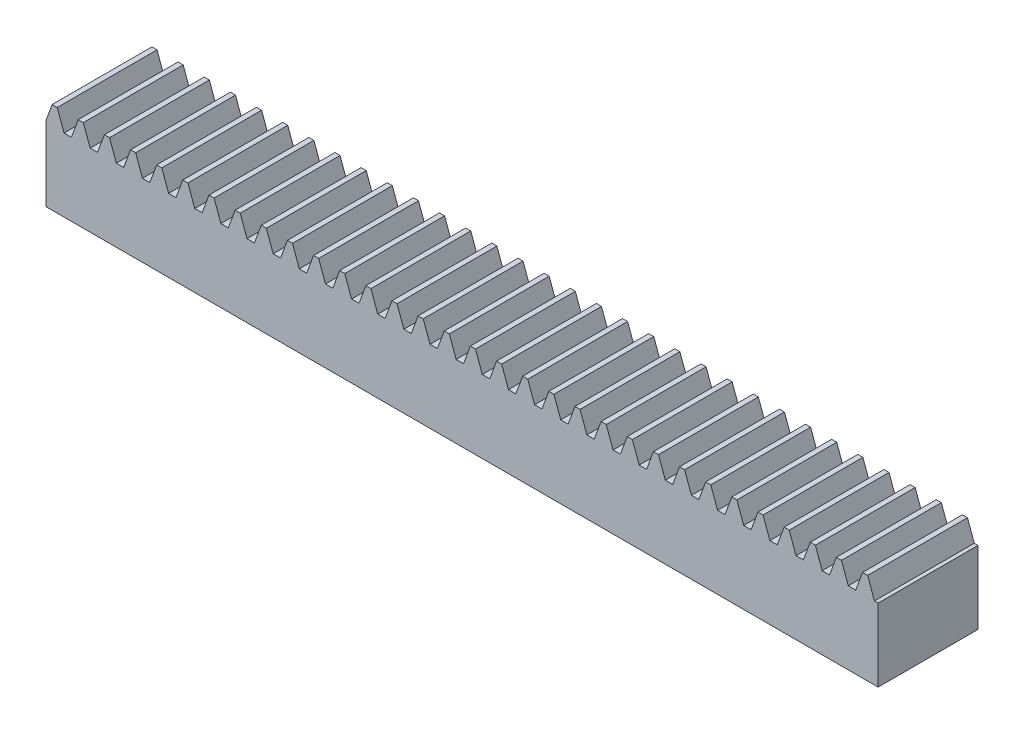
from build123d import *

# Parameters (mm, degrees)
BOSS_EXTRUDE1_DEPTH = 12


with BuildPart() as part:
    # Sketch1 → Boss-Extrude1 (new body)
    with BuildSketch(Plane.XY):
        Polygon((-49.267596403, 5.5), (-50, 3.487737656), (-50, -5.5), (50, -5.5), (50, 3.25), (49.55556463, 3.25), (48.736631603, 5.5), (48.121775747, 5.5), (47.30284272, 3.25), (46.41397198, 3.25), (45.595038953, 5.5), (44.980183097, 5.5), (44.16125007, 3.25), (43.27237933, 3.25), (42.453446303, 5.5), (41.838590447, 5.5), (41.01965742, 3.25), (40.13078668, 3.25), (39.311853653, 5.5), (38.696997797, 5.5), (37.87806477, 3.25), (36.98919403, 3.25), (36.170261003, 5.5), (35.555405147, 5.5), (34.73647212, 3.25), (33.84760138, 3.25), (33.028668353, 5.5), (32.413812497, 5.5), (31.59487947, 3.25), (30.70600873, 3.25), (29.887075703, 5.5), (29.272219847, 5.5), (28.45328682, 3.25), (27.56441608, 3.25), (26.745483053, 5.5), (26.130627197, 5.5), (25.31169417, 3.25), (24.42282343, 3.25), (23.603890403, 5.5), (22.989034547, 5.5), (22.17010152, 3.25), (21.28123078, 3.25), (20.462297753, 5.5), (19.847441897, 5.5), (19.02850887, 3.25), (18.13963813, 3.25), (17.320705103, 5.5), (16.705849247, 5.5), (15.88691622, 3.25), (14.99804548, 3.25), (14.179112453, 5.5), (13.564256597, 5.5), (12.74532357, 3.25), (11.85645283, 3.25), (11.037519803, 5.5), (10.422663947, 5.5), (9.60373092, 3.25), (8.71486018, 3.25), (7.895927153, 5.5), (7.281071297, 5.5), (6.46213827, 3.25), (5.57326753, 3.25), (4.754334503, 5.5), (4.139478647, 5.5), (3.32054562, 3.25), (2.43167488, 3.25), (1.612741853, 5.5), (0.997885997, 5.5), (0.17895297, 3.25), (-0.70991777, 3.25), (-1.528850797, 5.5), (-2.143706653, 5.5), (-2.96263968, 3.25), (-3.85151042, 3.25), (-4.670443447, 5.5), (-5.285299303, 5.5), (-6.10423233, 3.25), (-6.99310307, 3.25), (-7.812036097, 5.5), (-8.426891953, 5.5), (-9.24582498, 3.25), (-10.13469572, 3.25), (-10.953628747, 5.5), (-11.568484603, 5.5), (-12.38741763, 3.25), (-13.27628837, 3.25), (-14.095221397, 5.5), (-14.710077253, 5.5), (-15.52901028, 3.25), (-16.41788102, 3.25), (-17.236814047, 5.5), (-17.851669903, 5.5), (-18.67060293, 3.25), (-19.55947367, 3.25), (-20.378406697, 5.5), (-20.993262553, 5.5), (-21.81219558, 3.25), (-22.70106632, 3.25), (-23.519999347, 5.5), (-24.134855203, 5.5), (-24.95378823, 3.25), (-25.84265897, 3.25), (-26.661591997, 5.5), (-27.276447853, 5.5), (-28.09538088, 3.25), (-28.98425162, 3.25), (-29.803184647, 5.5), (-30.418040503, 5.5), (-31.23697353, 3.25), (-32.12584427, 3.25), (-32.944777297, 5.5), (-33.559633153, 5.5), (-34.37856618, 3.25), (-35.26743692, 3.25), (-36.086369947, 5.5), (-36.701225803, 5.5), (-37.52015883, 3.25), (-38.40902957, 3.25), (-39.227962597, 5.5), (-39.842818453, 5.5), (-40.66175148, 3.25), (-41.55062222, 3.25), (-42.369555247, 5.5), (-42.984411103, 5.5), (-43.80334413, 3.25), (-44.69221487, 3.25), (-45.511147897, 5.5), (-46.126003753, 5.5), (-46.94493678, 3.25), (-47.83380752, 3.25), (-48.652740547, 5.5), align=None)
    extrude(amount=BOSS_EXTRUDE1_DEPTH)


solid = part.part
